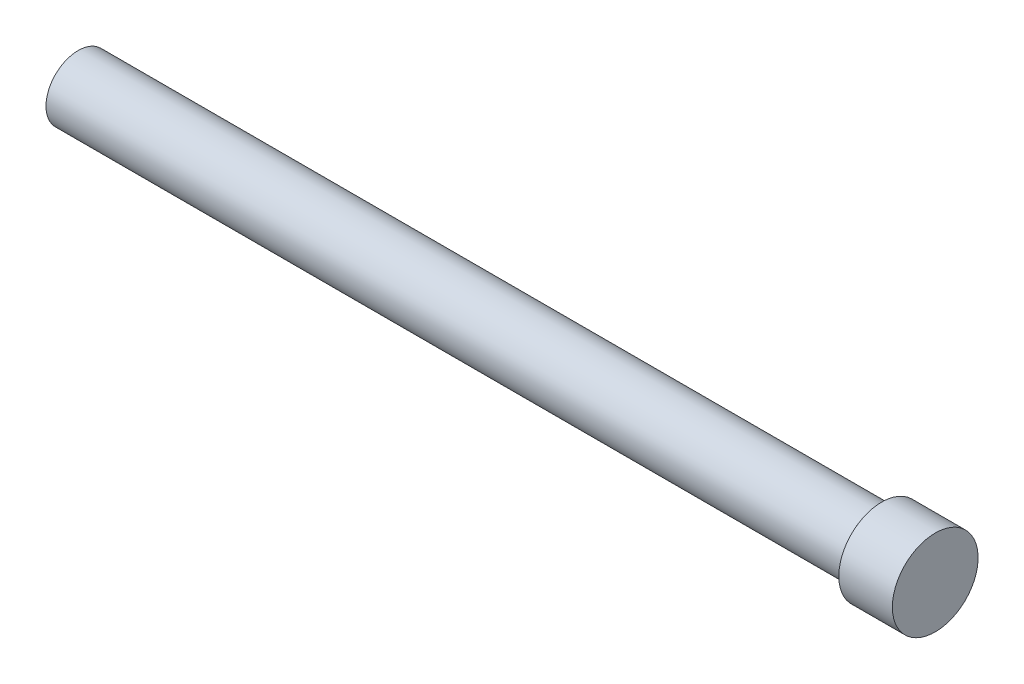
from build123d import *


with BuildPart() as part:
    # Esquisse2 → Révolution1 (revolve)
    with BuildSketch(Plane.XY, mode=Mode.PRIVATE) as r_volution1_sk:
        Polygon((-53.665704772, 0), (26.334295228, 0), (26.334295228, 4), (21.334295228, 4), (21.334295228, 3), (-53.665704772, 3), align=None)
    revolve(r_volution1_sk.sketch.rotate(Axis((-53.665704772, 0, 0), (1, 0, 0)), 90), axis=Axis((-53.665704772, 0, 0), (1, 0, 0)))


solid = part.part
